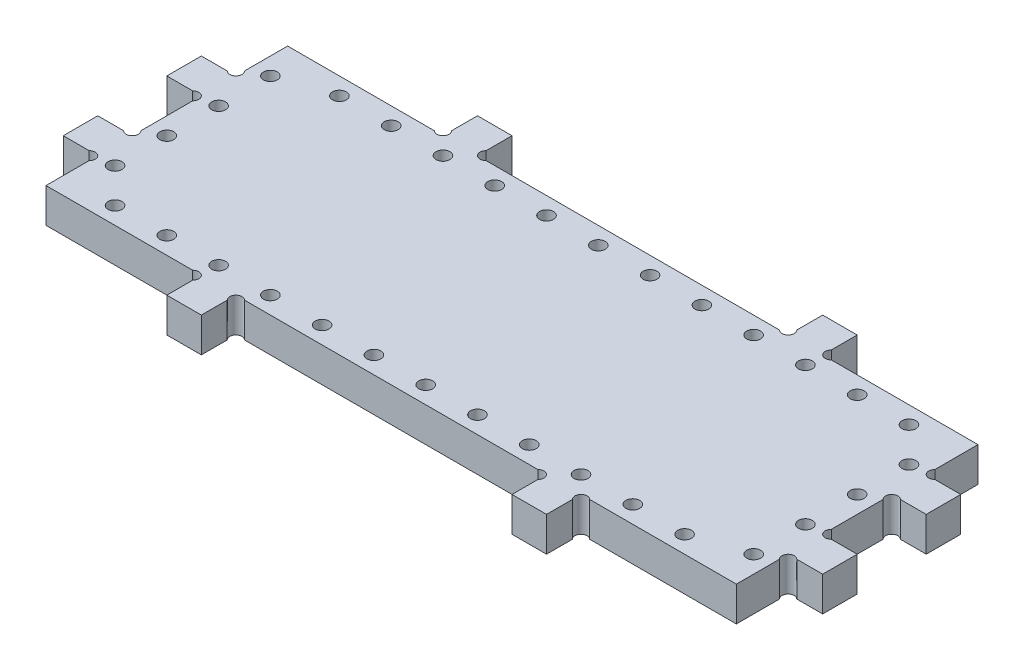
from build123d import *

# Parameters (mm, degrees)
SKETCH2_W                  = 254
SKETCH2_H                  = 88.9
RECTANGLE_EXTRUSION_DEPTH  = 12.7
SKETCH4_W                  = 12.7
SKETCH4_H                  = 12.7
FRONT_FACE_TABS_DEPTH      = 12.7
SKETCH6_R                  = 2.24536
TAB_CURVE_FRONT_BACK_DEPTH = 12.7
SKETCH7_W                  = 12.7
SKETCH7_H                  = 12.7
RIGHT_FACE_TABS_DEPTH      = 12.7
SKETCH8_R                  = 2.24536
TAB_CURVE_LEFT_RIGHT_DEPTH = 12.7
SKETCH9_R                  = 2.5527
NUT_STRIPS_CUT_DEPTH       = 152.471127612


with BuildPart() as part:
    # Sketch2 → Rectangle Extrusion (new body)
    with BuildSketch(Plane(origin=(0, 0, 0), x_dir=(1, 0, 0), z_dir=(0, 1, 0))):
        Rectangle(SKETCH2_W, SKETCH2_H)
    extrude(amount=RECTANGLE_EXTRUSION_DEPTH)

    # Sketch4 → Front Face Tabs (add)
    with BuildSketch(Plane.XY.offset(44.45)):
        with Locations((-63.5, 6.35)):
            Rectangle(SKETCH4_W, SKETCH4_H)
        with Locations((63.5, 6.35)):
            Rectangle(SKETCH4_W, SKETCH4_H)
    front_face_tabs = extrude(amount=FRONT_FACE_TABS_DEPTH)

    # Mirror Rear Face Tabs: Front Face Tabs across plane
    add(front_face_tabs.mirror(Plane.XY))

    # Sketch6 → Tab Curve Front Back (cut)
    with BuildSketch(Plane(origin=(0, 12.7, 0), x_dir=(1, 0, 0), z_dir=(0, 1, 0))):
        with Locations((-71.4375, 46.0375)):
            Circle(SKETCH6_R)
        with Locations((-55.5625, 46.0375)):
            Circle(SKETCH6_R)
        with Locations((55.5625, 46.0375)):
            Circle(SKETCH6_R)
        with Locations((71.4375, 46.0375)):
            Circle(SKETCH6_R)
        with Locations((71.4375, -46.0375)):
            Circle(SKETCH6_R)
        with Locations((55.5625, -46.0375)):
            Circle(SKETCH6_R)
        with Locations((-55.5625, -46.0375)):
            Circle(SKETCH6_R)
        with Locations((-71.4375, -46.0375)):
            Circle(SKETCH6_R)
    extrude(amount=-TAB_CURVE_FRONT_BACK_DEPTH, mode=Mode.SUBTRACT)

    # Sketch7 → Right Face Tabs (add)
    with BuildSketch(Plane(origin=(127, 0, 0), x_dir=(0, 0, -1), z_dir=(1, 0, 0))):
        with Locations((-19.05, 6.35)):
            Rectangle(SKETCH7_W, SKETCH7_H)
        with Locations((19.05, 6.35)):
            Rectangle(SKETCH7_W, SKETCH7_H)
    right_face_tabs = extrude(amount=RIGHT_FACE_TABS_DEPTH)

    # Mirror Left Face Tabs: Right Face Tabs across plane
    add(right_face_tabs.mirror(Plane(origin=(0, 0, 0), x_dir=(0, 0, 1), z_dir=(1, 0, 0))))

    # Sketch8 → Tab Curve Left Right (cut)
    with BuildSketch(Plane(origin=(0, 12.7, 0), x_dir=(1, 0, 0), z_dir=(0, 1, 0))):
        with Locations((128.5875, 26.9875)):
            Circle(SKETCH8_R)
        with Locations((128.5875, 11.1125)):
            Circle(SKETCH8_R)
        with Locations((128.5875, -11.1125)):
            Circle(SKETCH8_R)
        with Locations((128.5875, -26.9875)):
            Circle(SKETCH8_R)
        with Locations((-128.5875, -26.9875)):
            Circle(SKETCH8_R)
        with Locations((-128.5875, -11.1125)):
            Circle(SKETCH8_R)
        with Locations((-128.5875, 11.1125)):
            Circle(SKETCH8_R)
        with Locations((-128.5875, 26.9875)):
            Circle(SKETCH8_R)
    extrude(amount=-TAB_CURVE_LEFT_RIGHT_DEPTH, mode=Mode.SUBTRACT)

    # Sketch9 → Nut Strips Cut (cut, through all)
    with BuildSketch(Plane.XZ):
        with Locations(Location((-107.95, 38.1, 0), (0, 0, 270))):
            Circle(SKETCH9_R)
        with Locations(Location((-120.65, 25.4, 0), (0, 0, 270))):
            Circle(SKETCH9_R)
        with Locations(Location((-120.65, 6.35, 0), (0, 0, 270))):
            Circle(SKETCH9_R)
        with Locations(Location((-120.65, -12.7, 0), (0, 0, 270))):
            Circle(SKETCH9_R)
        with Locations(Location((-120.65, -31.75, 0), (0, 0, 270))):
            Circle(SKETCH9_R)
        with Locations(Location((-88.9, 38.1, 0), (0, 0, 270))):
            Circle(SKETCH9_R)
        with Locations(Location((-69.85, 38.1, 0), (0, 0, 270))):
            Circle(SKETCH9_R)
        with Locations(Location((-50.8, 38.1, 0), (0, 0, 270))):
            Circle(SKETCH9_R)
        with Locations(Location((-31.75, 38.1, 0), (0, 0, 270))):
            Circle(SKETCH9_R)
        with Locations(Location((-12.7, 38.1, 0), (0, 0, 270))):
            Circle(SKETCH9_R)
        with Locations(Location((6.35, 38.1, 0), (0, 0, 270))):
            Circle(SKETCH9_R)
        with Locations(Location((25.4, 38.1, 0), (0, 0, 270))):
            Circle(SKETCH9_R)
        with Locations(Location((44.45, 38.1, 0), (0, 0, 270))):
            Circle(SKETCH9_R)
        with Locations(Location((63.5, 38.1, 0), (0, 0, 270))):
            Circle(SKETCH9_R)
        with Locations(Location((82.55, 38.1, 0), (0, 0, 270))):
            Circle(SKETCH9_R)
        with Locations(Location((101.6, 38.1, 0), (0, 0, 270))):
            Circle(SKETCH9_R)
        with Locations(Location((107.95, -38.1, 0), (0, 0, 270))):
            Circle(SKETCH9_R)
        with Locations(Location((120.65, -25.4, 0), (0, 0, 270))):
            Circle(SKETCH9_R)
        with Locations(Location((120.65, -6.35, 0), (0, 0, 270))):
            Circle(SKETCH9_R)
        with Locations(Location((120.65, 12.7, 0), (0, 0, 270))):
            Circle(SKETCH9_R)
        with Locations(Location((120.65, 31.75, 0), (0, 0, 270))):
            Circle(SKETCH9_R)
        with Locations(Location((88.9, -38.1, 0), (0, 0, 270))):
            Circle(SKETCH9_R)
        with Locations(Location((69.85, -38.1, 0), (0, 0, 270))):
            Circle(SKETCH9_R)
        with Locations(Location((50.8, -38.1, 0), (0, 0, 270))):
            Circle(SKETCH9_R)
        with Locations(Location((31.75, -38.1, 0), (0, 0, 270))):
            Circle(SKETCH9_R)
        with Locations(Location((12.7, -38.1, 0), (0, 0, 270))):
            Circle(SKETCH9_R)
        with Locations(Location((-6.35, -38.1, 0), (0, 0, 270))):
            Circle(SKETCH9_R)
        with Locations(Location((-25.4, -38.1, 0), (0, 0, 270))):
            Circle(SKETCH9_R)
        with Locations(Location((-44.45, -38.1, 0), (0, 0, 270))):
            Circle(SKETCH9_R)
        with Locations(Location((-63.5, -38.1, 0), (0, 0, 270))):
            Circle(SKETCH9_R)
        with Locations(Location((-82.55, -38.1, 0), (0, 0, 270))):
            Circle(SKETCH9_R)
        with Locations(Location((-101.6, -38.1, 0), (0, 0, 270))):
            Circle(SKETCH9_R)
    extrude(amount=-NUT_STRIPS_CUT_DEPTH, mode=Mode.SUBTRACT)


solid = part.part
